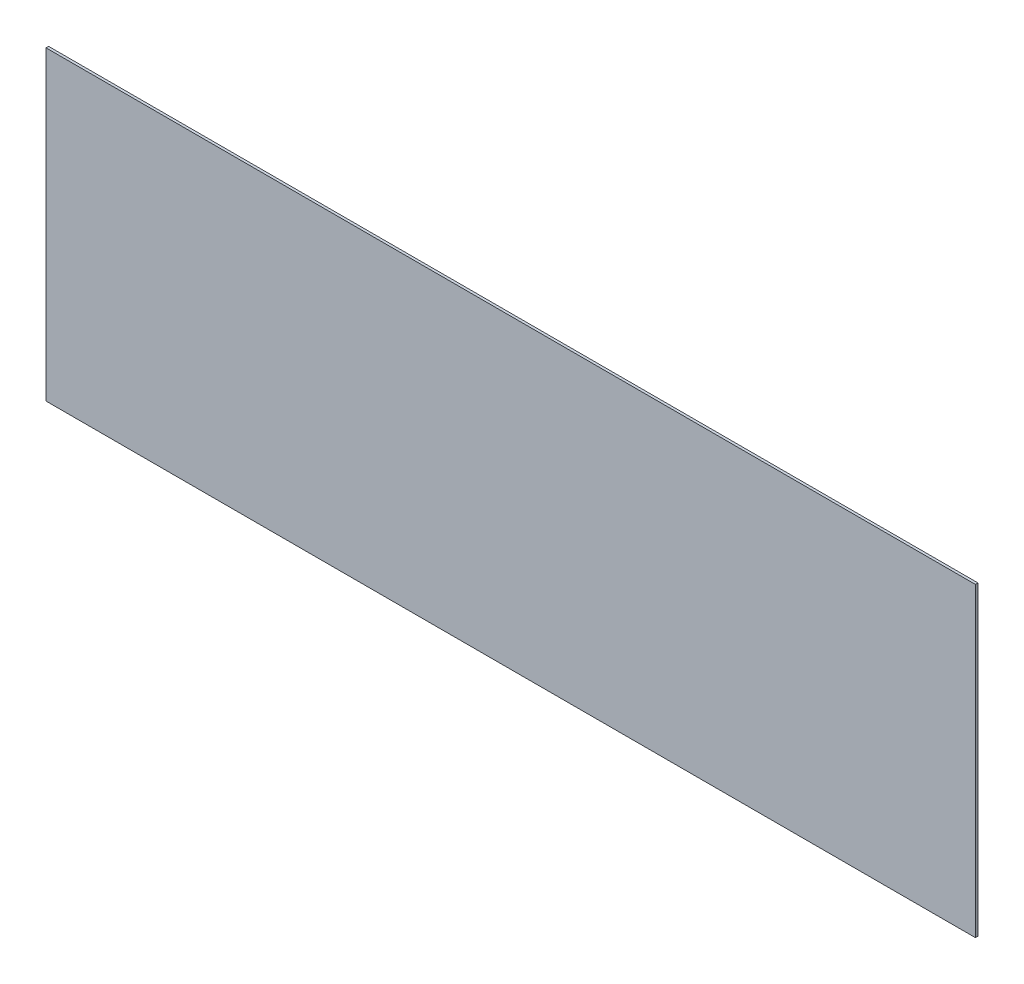
from build123d import *

# Parameters (mm, degrees)
SKETCH_1_W      = 360
SKETCH_1_H      = 118.5
EXTRUDE_1_DEPTH = 1


with BuildPart() as part:
    # 草图1 → 凸台-拉伸1 (new body)
    with BuildSketch(Plane.XY):
        with Locations((-190, 215.75)):
            Rectangle(SKETCH_1_W, SKETCH_1_H)
    extrude(amount=-EXTRUDE_1_DEPTH)


solid = part.part
